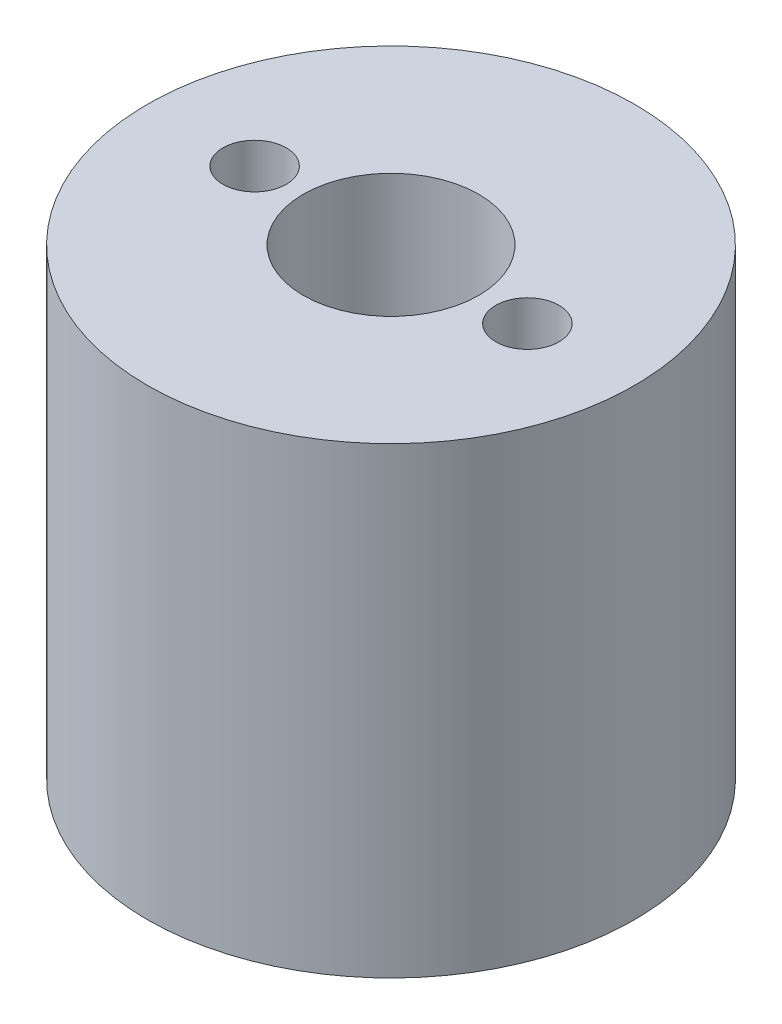
from build123d import *

# Parameters (mm, degrees)
SKETCH_1_R          = 10
SKETCH_1_R_2        = 2.1
EXTRUDE_1_DEPTH     = 5
SKETCH_2_R          = 10
SKETCH_2_R_2        = 3.6
EXTRUDE_2_DEPTH     = 14
SKETCH_3_R          = 1.3
CUT_EXTRUDE_1_DEPTH = 24.685438565


with BuildPart() as part:
    # ｽｹｯﾁ1 → ﾎﾞｽ - 押し出し1 (new body)
    with BuildSketch(Plane(origin=(0, 0, 0), x_dir=(1, 0, 0), z_dir=(0, 1, 0))):
        with Locations(Location((0, 0, 0), (0, 0, 270))):
            Circle(SKETCH_1_R)
        with Locations(Location((0, 0, 0), (0, 0, 270))):
            Circle(SKETCH_1_R_2, mode=Mode.SUBTRACT)
    extrude(amount=EXTRUDE_1_DEPTH)

    # ｽｹｯﾁ2 → ﾎﾞｽ - 押し出し2 (add)
    with BuildSketch(Plane(origin=(0, 5, 0), x_dir=(1, 0, 0), z_dir=(0, 1, 0))):
        with Locations(Location((0, 0, 0), (0, 0, 270))):
            Circle(SKETCH_2_R)
        with Locations(Location((0, 0, 0), (0, 0, 270))):
            Circle(SKETCH_2_R_2, mode=Mode.SUBTRACT)
    extrude(amount=EXTRUDE_2_DEPTH)

    # ｽｹｯﾁ3 → ｶｯﾄ - 押し出し1 (cut, through all)
    with BuildSketch(Plane(origin=(0, 19, 0), x_dir=(1, 0, 0), z_dir=(0, 1, 0))):
        with Locations(Location((-5.6, 0, 0), (0, 0, 270))):
            Circle(SKETCH_3_R)
        with Locations(Location((5.6, 0, 0), (0, 0, 270))):
            Circle(SKETCH_3_R)
    extrude(amount=-CUT_EXTRUDE_1_DEPTH, mode=Mode.SUBTRACT)


solid = part.part
